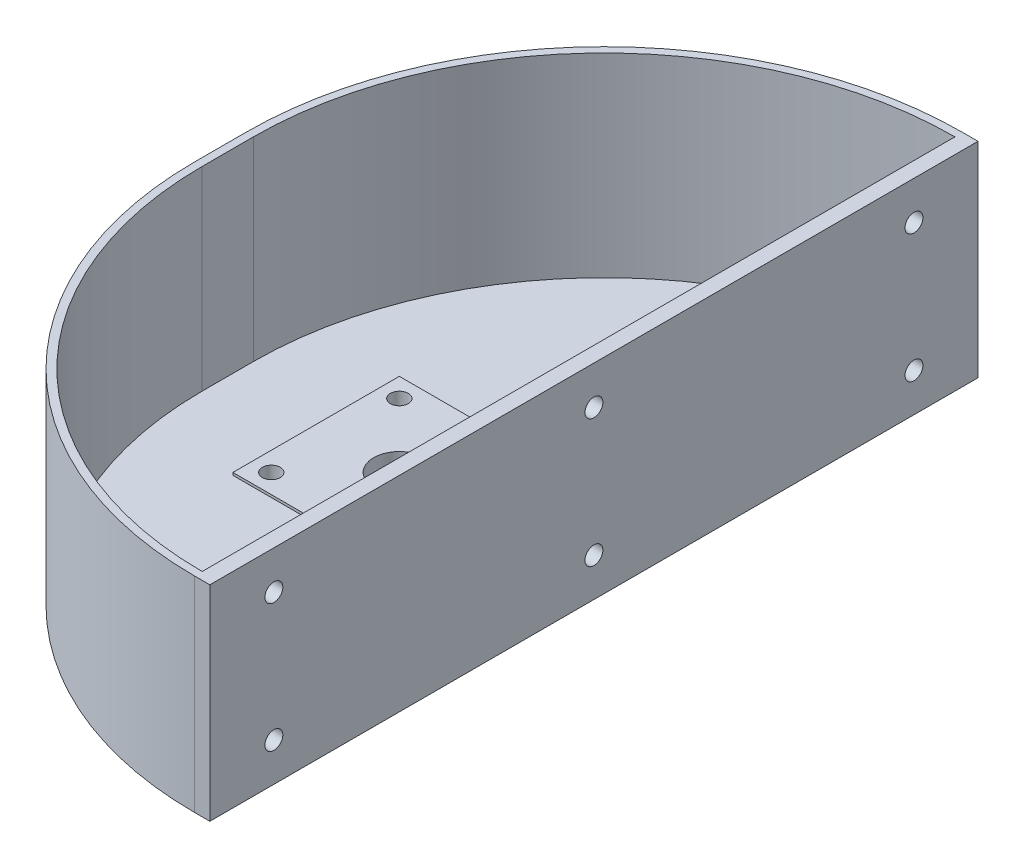
from build123d import *

# Parameters (mm, degrees)
SKETCH_1_W          = 140
SKETCH_1_H          = 300
EXTRUDE_1_DEPTH     = 4
SKETCH_2_W          = 6
SKETCH_2_H          = 300
EXTRUDE_2_DEPTH     = 80
FILLET_1_R          = 140
SKETCH_3_W          = 65
SKETCH_3_H          = 65
EXTRUDE_3_DEPTH     = 1
SKETCH_4_R          = 3.5
SKETCH_4_R_2        = 10
CUT_EXTRUDE_1_DEPTH = 185.122242002
EXTRUDE_START       = 76
EXTRUDE_1_2_DEPTH   = 76
SKETCH_16_R         = 3.5
CUT_EXTRUDE_6_DEPTH = 20


with BuildPart() as part:
    # Эскиз1 → Extrude 1 (new body)
    with BuildSketch(Plane(origin=(0, 0, 0), x_dir=(1, 0, 0), z_dir=(0, 1, 0))):
        Rectangle(SKETCH_1_W, SKETCH_1_H)
    extrude(amount=EXTRUDE_1_DEPTH)

    # Эскиз2 → Бобышка-Вытянуть2 (add)
    with BuildSketch(Plane(origin=(0, 0, 0), x_dir=(1, 0, 0), z_dir=(0, 1, 0))):
        with Locations((73, 0)):
            Rectangle(SKETCH_2_W, SKETCH_2_H)
    extrude(amount=EXTRUDE_2_DEPTH)

    # Скругление1
    fillet_1_edges = [part.edges().sort_by_distance(p)[0] for p in [
        (-70, 2, -150),
        (-70, 2, 150),
    ]]
    fillet(fillet_1_edges, radius=FILLET_1_R)

    # Эскиз3 → Бобышка-Вытянуть3 (add)
    with BuildSketch(Plane(origin=(0, 4, 0), x_dir=(1, 0, 0), z_dir=(0, 1, 0))):
        Rectangle(SKETCH_3_W, SKETCH_3_H)
    extrude(amount=EXTRUDE_3_DEPTH)

    # Эскиз4 → Вырез-Вытянуть1 (cut, through all)
    with BuildSketch(Plane(origin=(0, 5, 0), x_dir=(1, 0, 0), z_dir=(0, 1, 0))):
        with Locations(Location((-25, 25, 0), (0, 0, 270))):
            Circle(SKETCH_4_R)
        with Locations(Location((25, 25, 0), (0, 0, 270))):
            Circle(SKETCH_4_R)
        with Locations(Location((-25, -25, 0), (0, 0, 270))):
            Circle(SKETCH_4_R)
        with Locations(Location((25, -25, 0), (0, 0, 270))):
            Circle(SKETCH_4_R)
        with Locations(Location((0, 0, 0), (0, 0, 270))):
            Circle(SKETCH_4_R_2)
    extrude(amount=-CUT_EXTRUDE_1_DEPTH, mode=Mode.SUBTRACT)

    # Эскиз9 → Extrude 1 2 (add)
    with BuildSketch(Plane(origin=(0, 4, 0), x_dir=(1, 0, 0), z_dir=(0, 1, 0)).offset(EXTRUDE_START)):
        with BuildLine():
            ThreePointArc((70, 147), (-26.873629023, 106.873629023), (-67, 10))
            Line((-67, 10), (-67, -10))
            ThreePointArc((-67, -10), (-26.873629023, -106.873629023), (70, -147))
            Line((70, -147), (70, -150))
            ThreePointArc((70, -150), (-28.994949366, -108.994949366), (-70, -10))
            Line((-70, -10), (-70, 10))
            ThreePointArc((-70, 10), (-28.994949366, 108.994949366), (70, 150))
            Line((70, 150), (70, 147))
        make_face()
    extrude(amount=-EXTRUDE_1_2_DEPTH)

    # Эскиз16 → Вырез-Вытянуть6 (cut)
    with BuildSketch(Plane(origin=(76, 0, 0), x_dir=(0, 0, -1), z_dir=(1, 0, 0))):
        with Locations((0, 65)):
            Circle(SKETCH_16_R)
        with Locations((0, 15)):
            Circle(SKETCH_16_R)
        with Locations((125, 65)):
            Circle(SKETCH_16_R)
        with Locations((-125, 65)):
            Circle(SKETCH_16_R)
        with Locations((-125, 15)):
            Circle(SKETCH_16_R)
        with Locations((125, 15)):
            Circle(SKETCH_16_R)
    extrude(amount=-CUT_EXTRUDE_6_DEPTH, mode=Mode.SUBTRACT)


solid = part.part
